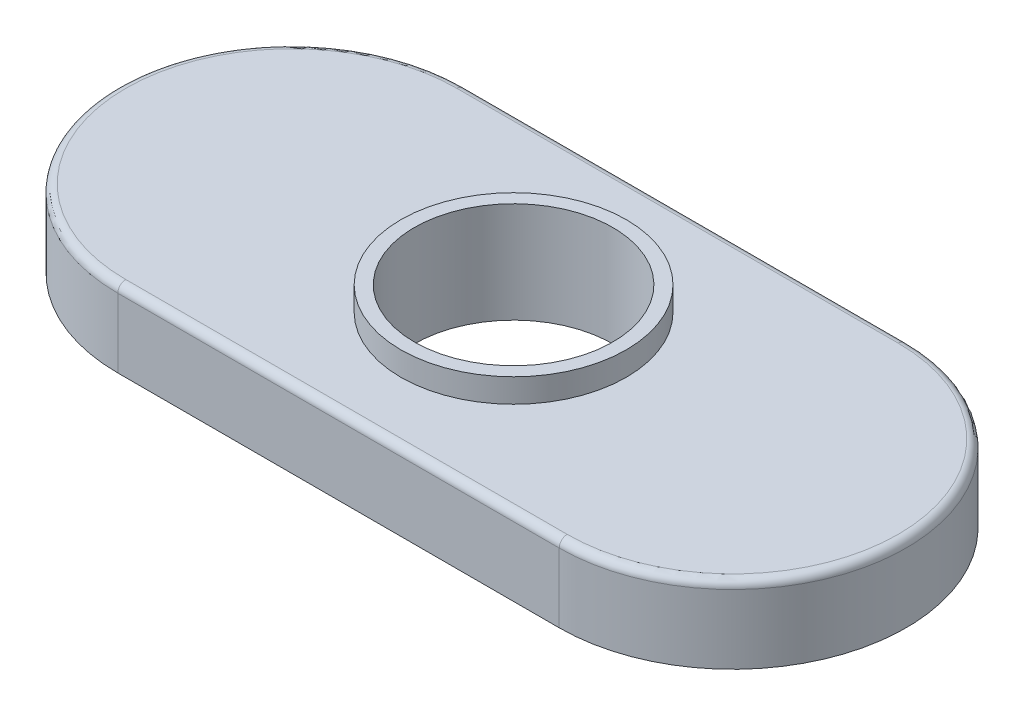
from build123d import *

# Parameters (mm, degrees)
BOSS_EXTRUDE1_DEPTH = 2.4638
SKETCH2_R           = 3.6068
BOSS_EXTRUDE3_DEPTH = 0.762
SKETCH5_R           = 3.175
CUT_EXTRUDE2_DEPTH  = 21.693152562
FILLET1_R           = 0.254


with BuildPart() as part:
    # Sketch1 → Boss-Extrude1 (new body)
    with BuildSketch(Plane(origin=(0, 0, 0), x_dir=(1, 0, 0), z_dir=(0, 1, 0))):
        with BuildLine():
            Line((0, 5.5499), (14.1224, 5.5499))
            ThreePointArc((14.1224, 5.5499), (19.6723, 0), (14.1224, -5.5499))
            Line((14.1224, -5.5499), (0, -5.5499))
            ThreePointArc((0, -5.5499), (-5.5499, 0), (0, 5.5499))
        make_face()
    extrude(amount=BOSS_EXTRUDE1_DEPTH)

    # Sketch2 → Boss-Extrude3 (add)
    with BuildSketch(Plane(origin=(0, 2.4638, 0), x_dir=(1, 0, 0), z_dir=(0, 1, 0))):
        with Locations(Location((7.112, 0, 0), (0, 0, 90))):
            Circle(SKETCH2_R)
    extrude(amount=BOSS_EXTRUDE3_DEPTH)

    # Sketch5 → Cut-Extrude2 (cut, through all)
    with BuildSketch(Plane(origin=(0, 3.2258, 0), x_dir=(1, 0, 0), z_dir=(0, 1, 0))):
        with Locations(Location((7.112, 0, 0), (0, 0, 270))):
            Circle(SKETCH5_R)
    extrude(amount=-CUT_EXTRUDE2_DEPTH, mode=Mode.SUBTRACT)

    # Fillet1
    fillet1_edges = [part.edges().sort_by_distance(p)[0] for p in [
        (19.6723, 2.4638, 0),
        (7.0612, 2.4638, -5.5499),
        (-5.5499, 2.4638, 0),
        (7.0612, 2.4638, 5.5499),
    ]]
    fillet(fillet1_edges, radius=FILLET1_R)


solid = part.part
